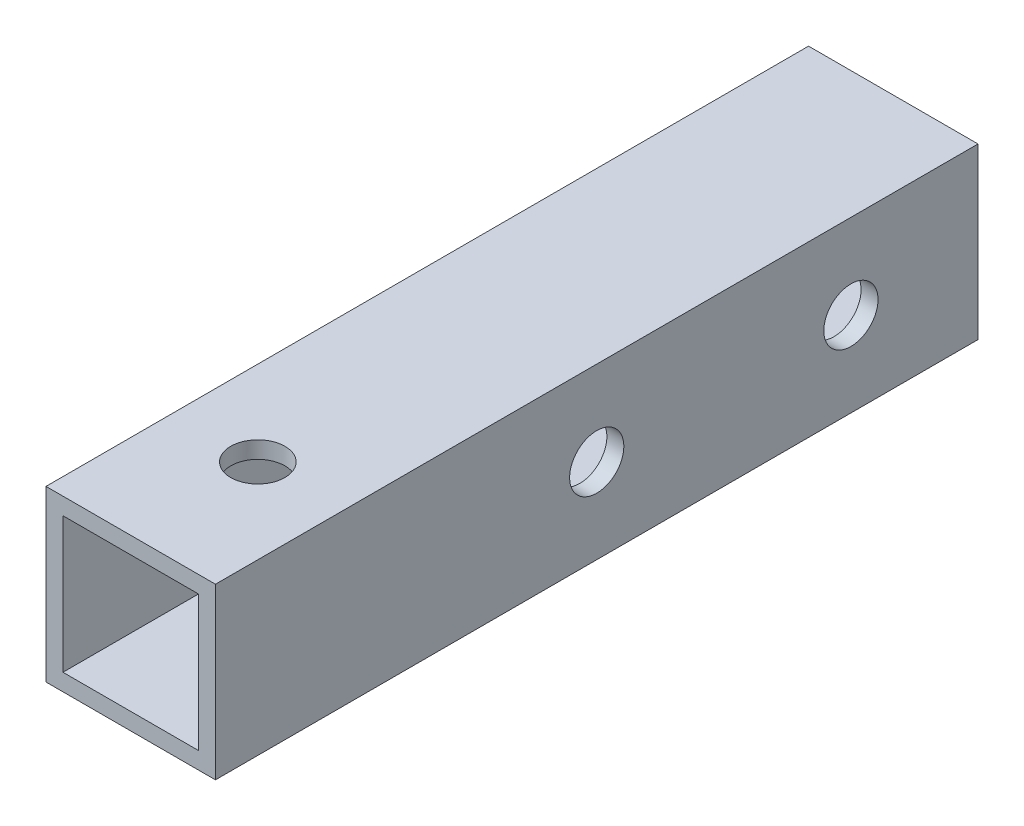
from build123d import *

# Parameters (mm, degrees)
SKETCH_1_W          = 10
SKETCH_1_H          = 10
SKETCH_1_W_2        = 8
SKETCH_1_H_2        = 8
EXTRUDE_1_DEPTH     = 45
SKETCH_2_R          = 1.6
CUT_EXTRUDE_1_DEPTH = 47.368092477
SKETCH_3_R          = 1.6
CUT_EXTRUDE_2_DEPTH = 47.368092477


with BuildPart() as part:
    # ｽｹｯﾁ1 → 押し出し-薄板1 (new body)
    with BuildSketch(Plane.XY):
        Rectangle(SKETCH_1_W, SKETCH_1_H)
        Rectangle(SKETCH_1_W_2, SKETCH_1_H_2, mode=Mode.SUBTRACT)
    extrude(amount=EXTRUDE_1_DEPTH)

    # ｽｹｯﾁ2 → ｶｯﾄ - 押し出し1 (cut, through all)
    with BuildSketch(Plane(origin=(0, 5, 0), x_dir=(1, 0, 0), z_dir=(0, 1, 0))):
        with Locations(Location((0, -37.5, 0), (0, 0, 270))):
            Circle(SKETCH_2_R)
    extrude(amount=-CUT_EXTRUDE_1_DEPTH, mode=Mode.SUBTRACT)

    # ｽｹｯﾁ3 → ｶｯﾄ - 押し出し2 (cut, through all)
    with BuildSketch(Plane(origin=(5, 0, 0), x_dir=(0, 0, -1), z_dir=(1, 0, 0))):
        with Locations((-22.5, 0)):
            Circle(SKETCH_3_R)
        with Locations((-7.5, 0)):
            Circle(SKETCH_3_R)
    extrude(amount=-CUT_EXTRUDE_2_DEPTH, mode=Mode.SUBTRACT)


solid = part.part
